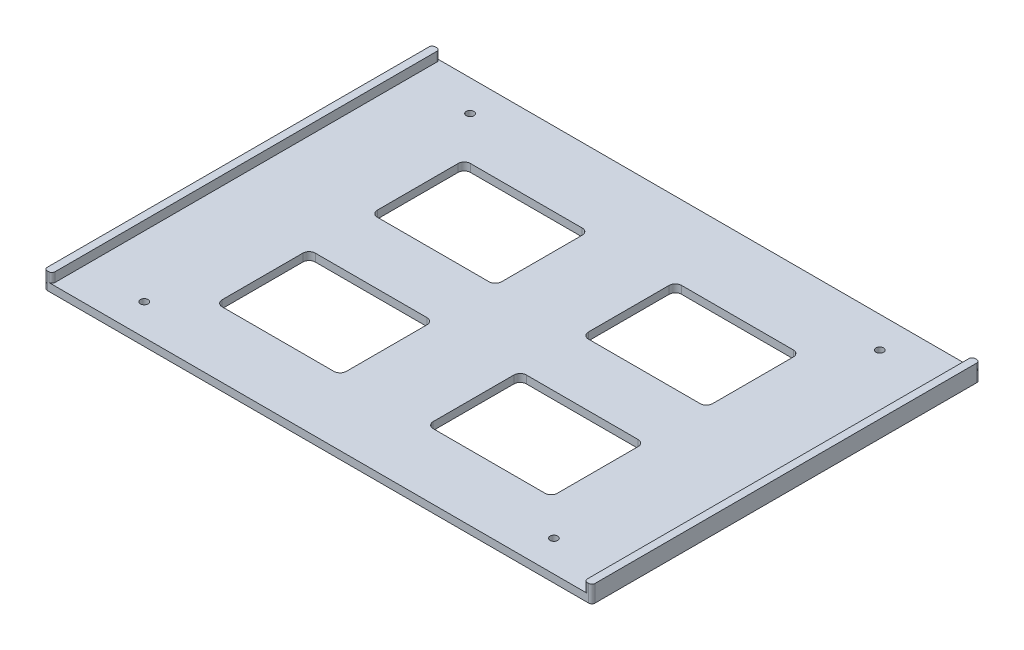
from build123d import *

# Parameters (mm, degrees)
SKETCH1_W                = 171.45
SKETCH1_H                = 125
SKETCH1_R                = 1.23
BOSS_EXTRUDE1_DEPTH      = 2.5
BOSS_EXTRUDE2_DEPTH      = 3
BOSS_EXTRUDE2_DEPTH_BACK = 2.5
SKETCH2_W                = 2.5
SKETCH2_H                = 125
CUT_EXTRUDE1_DEPTH       = 215.225587874
CUT_EXTRUDE1_DEPTH_BACK  = 215.225587874
SKETCH3_W                = 40
SKETCH3_H                = 30
FILLET1_R                = 2
FILLET2_R                = 1


with BuildPart() as part:
    # Sketch1 → Boss-Extrude1 (new body)
    with BuildSketch(Plane(origin=(0, 0, 0), x_dir=(1, 0, 0), z_dir=(0, 1, 0))):
        with Locations((85.725, -62.5)):
            Rectangle(SKETCH1_W, SKETCH1_H)
        with Locations(Location((19.725, -10, 0), (0, 0, 270))):
            Circle(SKETCH1_R, mode=Mode.SUBTRACT)
        with Locations(Location((151.725, -10, 0), (0, 0, 270))):
            Circle(SKETCH1_R, mode=Mode.SUBTRACT)
        with Locations(Location((19.725, -115, 0), (0, 0, 270))):
            Circle(SKETCH1_R, mode=Mode.SUBTRACT)
        with Locations(Location((151.725, -115, 0), (0, 0, 270))):
            Circle(SKETCH1_R, mode=Mode.SUBTRACT)
    extrude(amount=BOSS_EXTRUDE1_DEPTH)

    # Sketch2 → Boss-Extrude2 (add, two sides: drawn at the far end of the back side and taken through both)
    with BuildSketch(Plane(origin=(0, 2.5, 0), x_dir=(1, 0, 0), z_dir=(0, 1, 0)).offset(-BOSS_EXTRUDE2_DEPTH_BACK)):
        with Locations((-1.25, -62.5)):
            Rectangle(SKETCH2_W, SKETCH2_H)
        with Locations((172.7, -62.5)):
            Rectangle(SKETCH2_W, SKETCH2_H)
    extrude(amount=BOSS_EXTRUDE2_DEPTH + BOSS_EXTRUDE2_DEPTH_BACK)

    # Sketch3 → Cut-Extrude1 (cut, two sides: drawn at the far end of the back side and taken through both)
    with BuildSketch(Plane(origin=(0, 2.5, 0), x_dir=(1, 0, 0), z_dir=(0, 1, 0)).offset(-CUT_EXTRUDE1_DEPTH_BACK)):
        with Locations((51.725, -38.876953358)):
            Rectangle(SKETCH3_W, SKETCH3_H)
        with Locations((119.725, -38.876953358)):
            Rectangle(SKETCH3_W, SKETCH3_H)
        with Locations((51.725, -88.876953358)):
            Rectangle(SKETCH3_W, SKETCH3_H)
        with Locations((119.725, -88.876953358)):
            Rectangle(SKETCH3_W, SKETCH3_H)
    extrude(amount=CUT_EXTRUDE1_DEPTH + CUT_EXTRUDE1_DEPTH_BACK, mode=Mode.SUBTRACT)

    # Fillet1
    fillet1_edges = [part.edges().sort_by_distance(p)[0] for p in [
        (71.725, 1.25, 53.876953358),
        (139.725, 1.25, 23.876953358),
        (139.725, 1.25, 53.876953358),
        (99.725, 1.25, 53.876953358),
        (99.725, 1.25, 23.876953358),
        (31.725, 1.25, 103.876953358),
        (31.725, 1.25, 73.876953358),
        (71.725, 1.25, 73.876953358),
        (71.725, 1.25, 103.876953358),
        (99.725, 1.25, 103.876953358),
        (99.725, 1.25, 73.876953358),
        (139.725, 1.25, 73.876953358),
        (139.725, 1.25, 103.876953358),
        (31.725, 1.25, 53.876953358),
        (31.725, 1.25, 23.876953358),
        (71.725, 1.25, 23.876953358),
    ]]
    fillet(fillet1_edges, radius=FILLET1_R)

    # Fillet2
    fillet2_edges = [part.edges().sort_by_distance(p)[0] for p in [
        (0, 4, 0),
        (0, 4, 125),
        (-2.5, 2.75, 125),
        (-2.5, 2.75, 0),
        (171.45, 4, 125),
        (171.45, 4, 0),
        (173.95, 2.75, 0),
        (173.95, 2.75, 125),
    ]]
    fillet(fillet2_edges, radius=FILLET2_R)


solid = part.part
